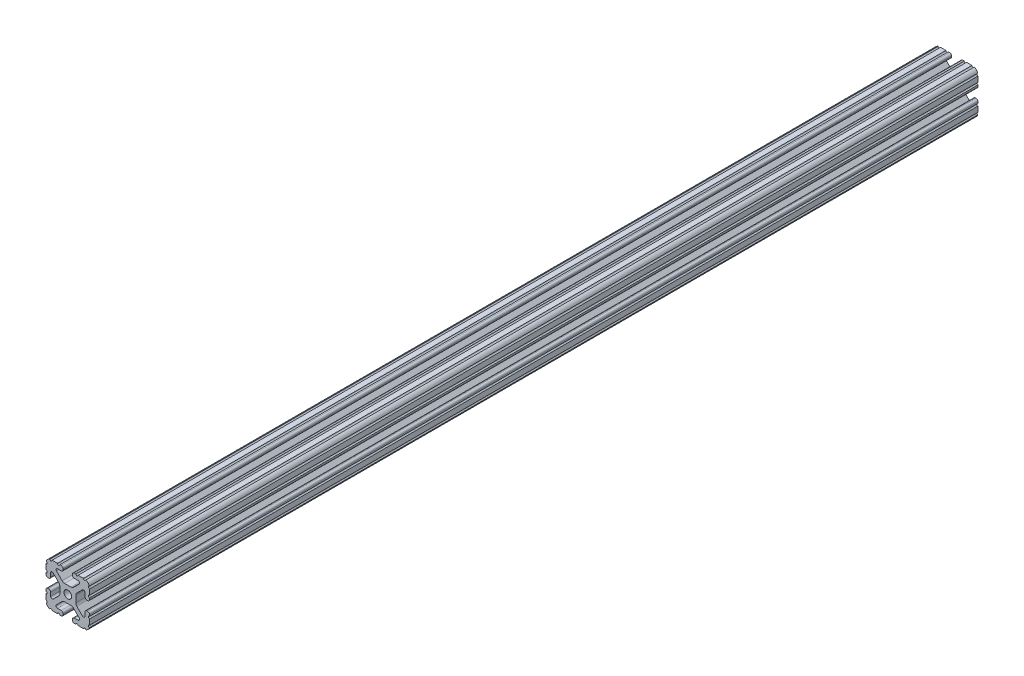
from build123d import *

# Parameters (mm, degrees)
BOSS_EXTRUDE1_DEPTH     = 388.1
CUT_EXTRUDE1_DEPTH      = 390.033950961
CUT_EXTRUDE1_DEPTH_BACK = 390.033950961
SKETCH5_R               = 1.016


with BuildPart() as part:
    # Sketch4 → Boss-Extrude1 (new, symmetric)
    with BuildSketch(Plane.XY):
        with BuildLine():
            Line((5.7912, -19.05), (14.3002, -19.05))
            ThreePointArc((14.3002, -19.05), (17.658815789, -17.658815789), (19.05, -14.3002))
            Line((19.05, -14.3002), (19.05, -5.7912))
            ThreePointArc((19.05, -5.7912), (18.544114832, -4.569885168), (17.3228, -4.064))
            Line((17.3228, -4.064), (16.7132, -4.064))
            ThreePointArc((16.7132, -4.064), (15.491885168, -4.569885168), (14.986, -5.7912))
            Line((14.986, -5.7912), (14.986, -8.996305235))
            ThreePointArc((14.986, -8.996305235), (14.189232738, -10.188751711), (12.782646215, -9.908964256))
            Line((12.782646215, -9.908964256), (7.888897763, -5.015215804))
            ThreePointArc((7.888897763, -5.015215804), (7.219915375, -4.014012907), (6.985, -2.833013566))
            Line((6.985, -2.833013566), (6.985, 0))
            Line((6.985, 0), (3.3274, 0))
            ThreePointArc((3.3274, 0), (2.352827104, -2.352827104), (0, -3.3274))
            Line((0, -3.3274), (0, -6.985))
            Line((0, -6.985), (2.833013566, -6.985))
            ThreePointArc((2.833013566, -6.985), (4.014012907, -7.219915375), (5.015215804, -7.888897763))
            Line((5.015215804, -7.888897763), (9.908964256, -12.782646215))
            ThreePointArc((9.908964256, -12.782646215), (10.188751711, -14.189232738), (8.996305235, -14.986))
            Line((8.996305235, -14.986), (5.7912, -14.986))
            ThreePointArc((5.7912, -14.986), (4.569885168, -15.491885168), (4.064, -16.7132))
            Line((4.064, -16.7132), (4.064, -17.3228))
            ThreePointArc((4.064, -17.3228), (4.569885168, -18.544114832), (5.7912, -19.05))
        make_face()
    extrude(amount=BOSS_EXTRUDE1_DEPTH, both=True)

    # Sketch5 → Cut-Extrude1 (cut, two sides: drawn at the far end of the back side and taken through both)
    with BuildSketch(Plane.XY.offset(-CUT_EXTRUDE1_DEPTH_BACK)):
        with Locations((14.739477062, -19.05)):
            Circle(SKETCH5_R)
        with Locations((7.980305235, -19.05)):
            Circle(SKETCH5_R)
        with Locations((19.05, -14.739477062)):
            Circle(SKETCH5_R)
        with Locations((19.05, -7.980305235)):
            Circle(SKETCH5_R)
    extrude(amount=CUT_EXTRUDE1_DEPTH + CUT_EXTRUDE1_DEPTH_BACK, mode=Mode.SUBTRACT)

    # Mirror1: part across plane


with BuildPart() as part_1:
    add(part.part)
    add(part.part.mirror(Plane(origin=(0, 0, 0), x_dir=(0, 0, 1), z_dir=(1, 0, 0))))

    # Mirror2: part across plane


with BuildPart() as part_2:
    add(part_1.part)
    add(part_1.part.mirror(Plane.ZX))


solid = part_2.part
